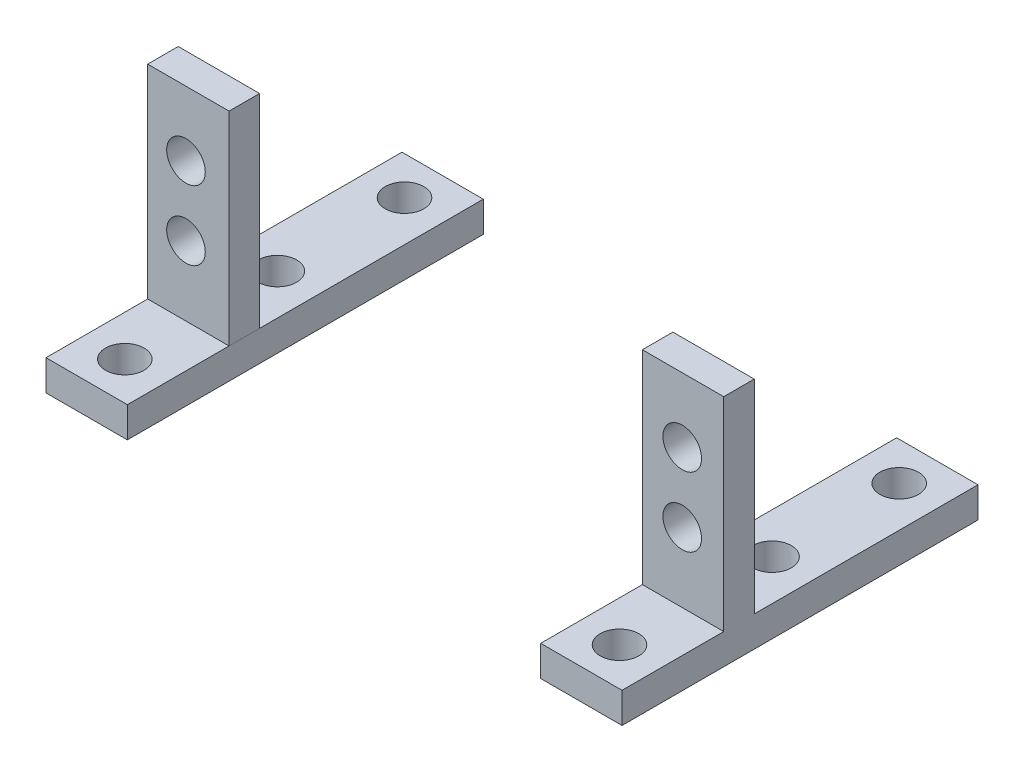
from build123d import *

# Parameters (mm, degrees)
SKETCH1_W                      = 8
SKETCH1_H                      = 35
BOSS_EXTRUDE1_DEPTH            = 3
BOSS_EXTRUDE1_2_DEPTH          = 3
SKETCH2_W                      = 8
SKETCH2_H                      = 3
BOSS_EXTRUDE2_DEPTH            = 20
SKETCH4_W                      = 1.89865
SKETCH4_H                      = 25
F_6_CLEARANCE_HOLE1_AT_2_COUNT = 2
F_6_CLEARANCE_HOLE1_AT_2_PITCH = 6.811261247
F_6_CLEARANCE_HOLE1_AT_3_COUNT = 2
F_6_CLEARANCE_HOLE1_AT_3_PITCH = 48.794466348
F_6_CLEARANCE_HOLE1_AT_4_COUNT = 2
F_6_CLEARANCE_HOLE1_AT_4_PITCH = 49.267567689
SKETCH6_W                      = 1.89865
SKETCH6_H                      = 3
F_6_CLEARANCE_HOLE2_AT_2_COUNT = 2
F_6_CLEARANCE_HOLE2_AT_2_PITCH = 12.5
F_6_CLEARANCE_HOLE2_AT_3_COUNT = 2
F_6_CLEARANCE_HOLE2_AT_3_PITCH = 27.5
F_6_CLEARANCE_HOLE2_AT_4_COUNT = 2
F_6_CLEARANCE_HOLE2_AT_4_PITCH = 48.64
F_6_CLEARANCE_HOLE2_AT_5_COUNT = 2
F_6_CLEARANCE_HOLE2_AT_5_PITCH = 50.220509754
F_6_CLEARANCE_HOLE2_AT_6_COUNT = 2
F_6_CLEARANCE_HOLE2_AT_6_PITCH = 55.875751449


with BuildPart() as part:
    # Sketch1 → Boss-Extrude1 (new body)
    with BuildSketch(Plane(origin=(0, 0, 0), x_dir=(1, 0, 0), z_dir=(0, 1, 0))):
        with Locations((4, 17.5)):
            Rectangle(SKETCH1_W, SKETCH1_H)
    extrude(amount=BOSS_EXTRUDE1_DEPTH)

    # Sketch2 → Boss-Extrude2 (add)
    with BuildSketch(Plane(origin=(0, 3, 0), x_dir=(1, 0, 0), z_dir=(0, 1, 0))):
        with Locations((4, 11.5)):
            Rectangle(SKETCH2_W, SKETCH2_H)
        with Locations((-44.64, 11.5)):
            Rectangle(SKETCH2_W, SKETCH2_H)
    extrude(amount=BOSS_EXTRUDE2_DEPTH)


with BuildPart() as body_2:
    # Sketch1 → Boss-Extrude1 2 (new body)
    with BuildSketch(Plane(origin=(0, 0, 0), x_dir=(1, 0, 0), z_dir=(0, 1, 0))):
        with Locations((-44.64, 17.5)):
            Rectangle(SKETCH1_W, SKETCH1_H)
    extrude(amount=BOSS_EXTRUDE1_2_DEPTH)

    # Sketch6 → #6 Clearance Hole2 (revolve, cut)
    with BuildSketch(Plane(origin=(-44.64, 3, -31.25), x_dir=(0, 0, 1), z_dir=(1, 0, 0))):
        with Locations((0.949325, 1.5)):
            Rectangle(SKETCH6_W, SKETCH6_H)
    f_6_clearance_hole2 = revolve(axis=Axis((-44.64, 9.35, -31.25), (0, -1, 0)), mode=Mode.SUBTRACT)

    # #6 Clearance Hole2 at 2: #6 Clearance Hole2 ×2
    with Locations(*[(0, 0, i * F_6_CLEARANCE_HOLE2_AT_2_PITCH) for i in range(1, F_6_CLEARANCE_HOLE2_AT_2_COUNT)]):
        add(f_6_clearance_hole2, mode=Mode.SUBTRACT)

    # #6 Clearance Hole2 at 3: #6 Clearance Hole2 ×2
    with Locations(*[(0, 0, i * F_6_CLEARANCE_HOLE2_AT_3_PITCH) for i in range(1, F_6_CLEARANCE_HOLE2_AT_3_COUNT)]):
        add(f_6_clearance_hole2, mode=Mode.SUBTRACT)


with BuildPart() as boss_extrude2_piece_1:
    # of the separate pieces the step leaves, piece 1, a body of its own (boss_extrude2_pieces)
    add(part.part.solids().sort_by_distance((0, 0, -35))[0])


with BuildPart() as boss_extrude2_piece_2:
    # of the separate pieces the step leaves, piece 2, a body of its own (boss_extrude2_pieces)
    add(part.part.solids().sort_by_distance((-48.64, 3, -13))[0])

    # Sketch4 → #6 Clearance Hole1 (revolve, cut)
    with BuildSketch(Plane(origin=(-44.876822142, 16.641573731, -10), x_dir=(0, -1, 0), z_dir=(1, 0, 0))):
        with Locations((0.949325, 12.5)):
            Rectangle(SKETCH4_W, SKETCH4_H)
    f_6_clearance_hole1 = revolve(axis=Axis((-44.876822142, 16.641573731, -3.65), (0, 0, -1)), mode=Mode.SUBTRACT)

    # #6 Clearance Hole1 at 2: #6 Clearance Hole1 ×2
    with Locations(*[(0, -i * F_6_CLEARANCE_HOLE1_AT_2_PITCH, 0) for i in range(1, F_6_CLEARANCE_HOLE1_AT_2_COUNT)]):
        add(f_6_clearance_hole1, mode=Mode.SUBTRACT)


with BuildPart() as boss_extrude2_piece_1_1:
    add(boss_extrude2_piece_1.part)

    # #6 Clearance Hole1 at 3: #6 Clearance Hole1 ×2
    with Locations(*[(i * F_6_CLEARANCE_HOLE1_AT_3_PITCH, 0, 0) for i in range(1, F_6_CLEARANCE_HOLE1_AT_3_COUNT)]):
        add(f_6_clearance_hole1, mode=Mode.SUBTRACT)

    # #6 Clearance Hole1 at 4: #6 Clearance Hole1 ×2
    with Locations(*[Vector(0.99039730672902, -0.13825040623413515, 0) * (i * F_6_CLEARANCE_HOLE1_AT_4_PITCH) for i in range(1, F_6_CLEARANCE_HOLE1_AT_4_COUNT)]):
        add(f_6_clearance_hole1, mode=Mode.SUBTRACT)

    # #6 Clearance Hole2 at 4: #6 Clearance Hole2 ×2
    with Locations(*[(i * F_6_CLEARANCE_HOLE2_AT_4_PITCH, 0, 0) for i in range(1, F_6_CLEARANCE_HOLE2_AT_4_COUNT)]):
        add(f_6_clearance_hole2, mode=Mode.SUBTRACT)

    # #6 Clearance Hole2 at 5: #6 Clearance Hole2 ×2
    with Locations(*[Vector(0.9685285999244415, 0, 0.2489022923325559) * (i * F_6_CLEARANCE_HOLE2_AT_5_PITCH) for i in range(1, F_6_CLEARANCE_HOLE2_AT_5_COUNT)]):
        add(f_6_clearance_hole2, mode=Mode.SUBTRACT)

    # #6 Clearance Hole2 at 6: #6 Clearance Hole2 ×2
    with Locations(*[Vector(0.8705028342092377, 0, 0.4921634033872129) * (i * F_6_CLEARANCE_HOLE2_AT_6_PITCH) for i in range(1, F_6_CLEARANCE_HOLE2_AT_6_COUNT)]):
        add(f_6_clearance_hole2, mode=Mode.SUBTRACT)


solid = Compound([body_2.part, boss_extrude2_piece_2.part, boss_extrude2_piece_1_1.part])
